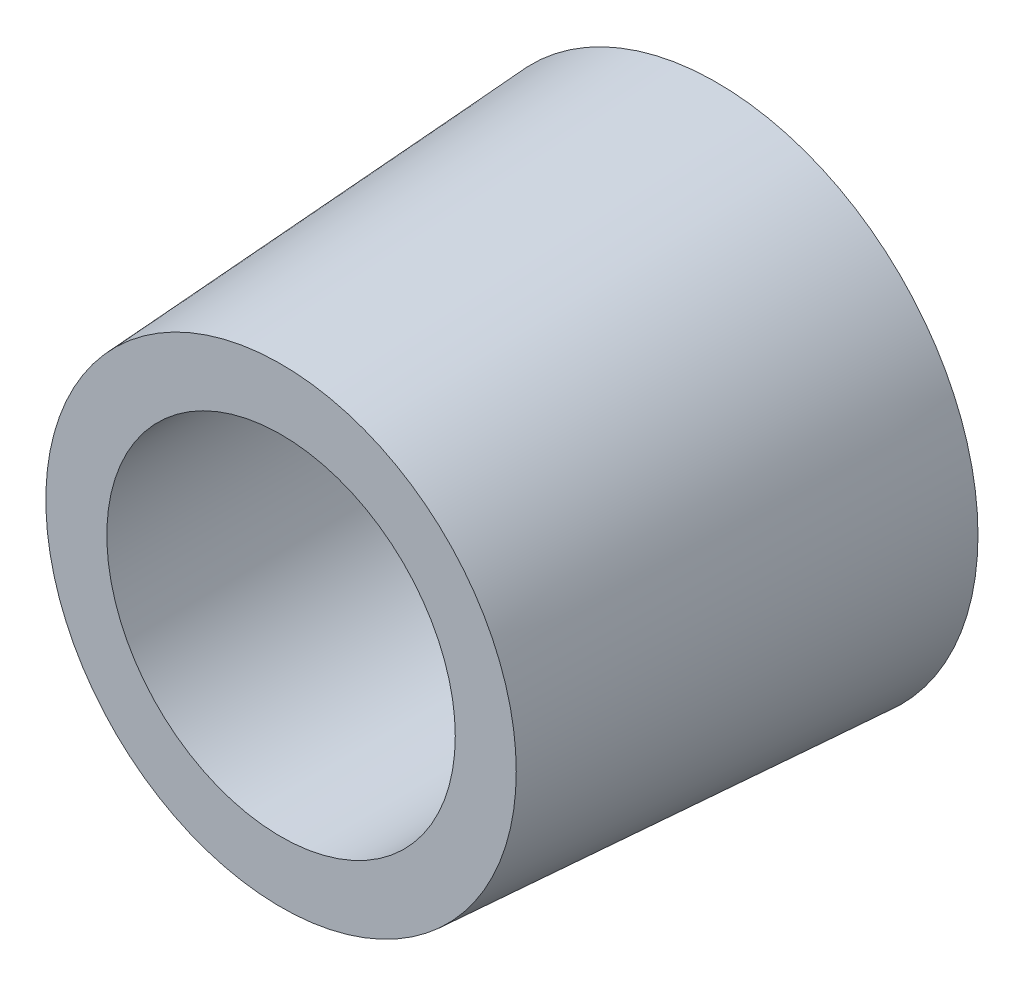
from build123d import *

# Parameters (mm, degrees)
SZKIC1_R                   = 3
SZKIC2_R                   = 2.7
SZKIC3_R                   = 2
WYTNIJ_WYCI_GNI_CIE1_DEPTH = 10


with BuildPart() as part:
    # Szkic1 → Wyciągnięcie po profilach1 section 0
    with BuildSketch(Plane.XY):
        Circle(SZKIC1_R)
    # Szkic2 → Wyciągnięcie po profilach1 section 1
    with BuildSketch(Plane.XY.offset(5)):
        Circle(SZKIC2_R)
    loft()

    # Szkic3 → Wytnij-wyciągnięcie1 (cut)
    with BuildSketch(Plane.XY.offset(5)):
        Circle(SZKIC3_R)
    extrude(amount=-WYTNIJ_WYCI_GNI_CIE1_DEPTH, mode=Mode.SUBTRACT)


solid = part.part
